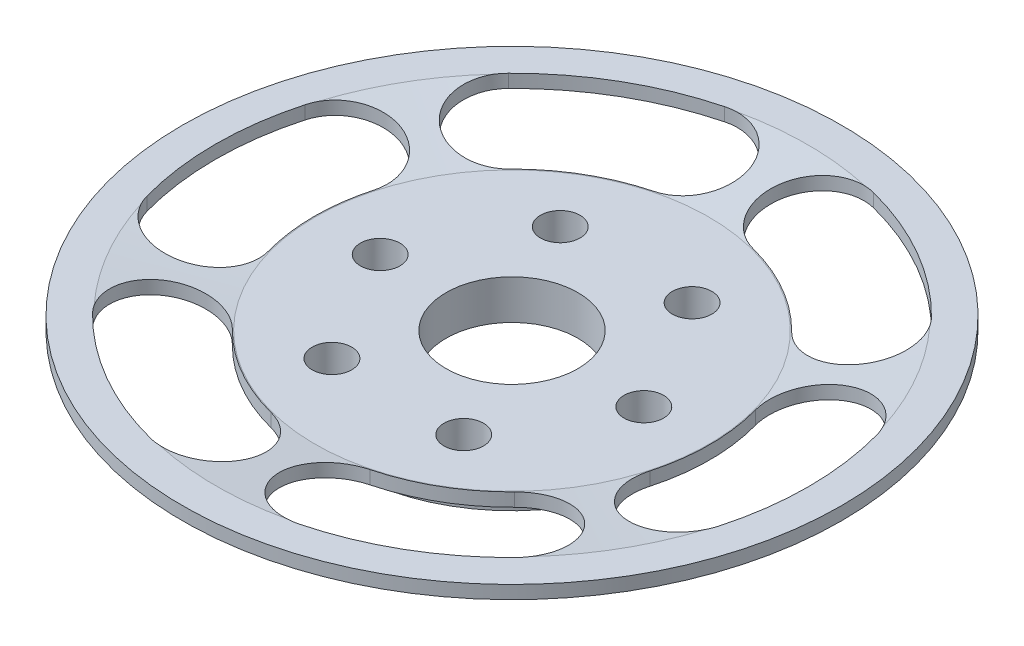
from build123d import *

# Parameters (mm, degrees)
CUT_EXTRUDE1_REACH = 37.412
CIRPATTERN1_COUNT  = 6
SKETCH3_R          = 5
CUT_EXTRUDE2_DEPTH = 36.580893761
SKETCH4_R          = 1.5
CUT_EXTRUDE3_DEPTH = 36.580893761
CIRPATTERN2_COUNT  = 6


with BuildPart() as part:
    # Sketch1 → Revolve1 (revolve)
    with BuildSketch(Plane.XY, mode=Mode.PRIVATE) as revolve1_sk:
        Polygon((22.433627025, 0), (25, 0), (25, -1), (22.5, -1), (15, -2), (12.5, -2), (12.5, -4), (0, -4), (0, -1), (14.933627025, -1), align=None)
    revolve(revolve1_sk.sketch.rotate(Axis((0, -1, 0), (0, -1, 0)), 180), axis=Axis((0, -1, 0), (0, -1, 0)))

    # Cut-Extrude1: up to this face of the body (flat: up to its plane)
    cut_extrude1_end = Plane(part.part.faces().sort_by_distance((23.140733806, 0, 0))[0])
    # Sketch2 → Cut-Extrude1 (cut, up to the picked face)
    with BuildSketch(Plane.XZ.offset(2), mode=Mode.PRIVATE) as cut_extrude1_sk1:
        with BuildLine():
            ThreePointArc((21.685248442, -6), (22.5, 0), (21.685248442, 6))
            ThreePointArc((21.685248442, 6), (17.071040369, 8.614208074), (14.456832295, 4))
            ThreePointArc((14.456832295, 4), (15, 0), (14.456832295, -4))
            ThreePointArc((14.456832295, -4), (17.071040369, -8.614208074), (21.685248442, -6))
        make_face()
    cut_extrude1_tool1 = split(extrude(cut_extrude1_sk1.sketch, amount=-CUT_EXTRUDE1_REACH, mode=Mode.PRIVATE), bisect_by=cut_extrude1_end, keep=Keep.BOTH, mode=Mode.PRIVATE)
    cut_extrude1 = cut_extrude1_tool1.solids().sort_by(Axis((18.356825, -2, 0), (0, 1, 0)))[0]
    add(cut_extrude1, mode=Mode.SUBTRACT)

    # CirPattern1: Cut-Extrude1 ×6 about axis
    cirpattern1_axis = Axis((0, 0, 0), (0, 1, 0))
    for i in range(1, CIRPATTERN1_COUNT):
        add(cut_extrude1.rotate(cirpattern1_axis, i * 360 / CIRPATTERN1_COUNT), mode=Mode.SUBTRACT)

    # Sketch3 → Cut-Extrude2 (cut, through all)
    with BuildSketch(Plane.XZ.offset(4)):
        Circle(SKETCH3_R)
    extrude(amount=-CUT_EXTRUDE2_DEPTH, mode=Mode.SUBTRACT)

    # Sketch4 → Cut-Extrude3 (cut, through all)
    with BuildSketch(Plane.XZ.offset(4)):
        with Locations((10, 0)):
            Circle(SKETCH4_R)
    cut_extrude3 = extrude(amount=-CUT_EXTRUDE3_DEPTH, mode=Mode.SUBTRACT)

    # CirPattern2: Cut-Extrude3 ×6 about axis
    cirpattern2_axis = Axis((0, 0, 0), (0, 1, 0))
    for i in range(1, CIRPATTERN2_COUNT):
        add(cut_extrude3.rotate(cirpattern2_axis, i * 360 / CIRPATTERN2_COUNT), mode=Mode.SUBTRACT)


solid = part.part
